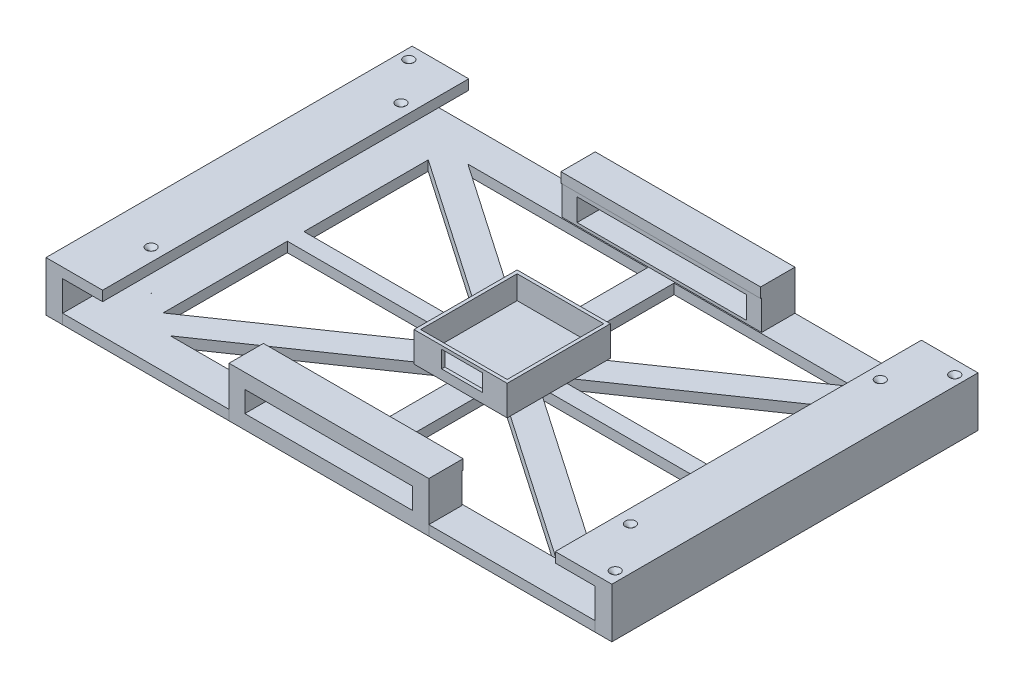
from build123d import *

# Parameters (mm, degrees)
BOSS_EXTRUDE1_DEPTH                   = 3
SKETCH1_5_W                           = 5
SKETCH1_5_H                           = 110
BOSS_EXTRUDE2_DEPTH                   = 12
SKETCH1_5_W_2                         = 60
SKETCH1_5_H_2                         = 10
BOSS_EXTRUDE2_2_DEPTH                 = 12
BOSS_EXTRUDE2_3_DEPTH                 = 12
BOSS_EXTRUDE2_4_DEPTH                 = 12
SKETCH2_W                             = 17
SKETCH2_H                             = 110
SKETCH2_W_2                           = 60
SKETCH2_H_2                           = 10.3125
BOSS_EXTRUDE3_DEPTH                   = 3
SKETCH3_W                             = 50.351183416
SKETCH3_H                             = 6.317122643
CUT_EXTRUDE1_DEPTH                    = 12
SKETCH4_W                             = 50.90857659
SKETCH4_H                             = 6.688718092
CUT_EXTRUDE2_DEPTH                    = 12
SKETCH5_W                             = 28
SKETCH5_H                             = 31
BOSS_EXTRUDE4_DEPTH                   = 9
SKETCH6_W                             = 26
SKETCH6_H                             = 29
CUT_EXTRUDE3_DEPTH                    = 7
SKETCH7_W                             = 12.321460949
SKETCH7_H                             = 5.119870138
CUT_EXTRUDE4_DEPTH                    = 2
F_97_0_0059_DIAMETER_HOLE9_AT_2_COUNT = 2
F_97_0_0059_DIAMETER_HOLE9_AT_2_PITCH = 75.062280812
F_97_0_0059_DIAMETER_HOLE9_AT_3_COUNT = 2
F_97_0_0059_DIAMETER_HOLE9_AT_3_PITCH = 162.38349121
F_97_0_0059_DIAMETER_HOLE9_AT_4_COUNT = 2
F_97_0_0059_DIAMETER_HOLE9_AT_4_PITCH = 143.993236706


with BuildPart() as part:
    # Sketch1 → Boss-Extrude1 (new body)
    with BuildSketch(Plane(origin=(0, 0, 0), x_dir=(1, 0, 0), z_dir=(0, 1, 0))):
        Polygon((0, 0), (50, 0), (50, 10), (110, 10), (110, 0), (160, 0), (160, 110), (110, 110), (110, 100), (50, 100), (50, 110), (0, 110), align=None)
        Polygon((22.060541032, 10.3125), (76, 47.39587804), (76, 10.3125), align=None, mode=Mode.SUBTRACT)
        Polygon((15, 15.16662196), (15, 52.5), (69.303095331, 52.5), align=None, mode=Mode.SUBTRACT)
        Polygon((84, 10.3125), (84, 47.39587804), (137.939458968, 10.3125), align=None, mode=Mode.SUBTRACT)
        Polygon((15, 57.5), (15, 94.83337804), (69.303095331, 57.5), align=None, mode=Mode.SUBTRACT)
        Polygon((145, 15.16662196), (90.696904669, 52.5), (145, 52.5), align=None, mode=Mode.SUBTRACT)
        Polygon((22.060541032, 99.6875), (76, 99.6875), (76, 62.60412196), align=None, mode=Mode.SUBTRACT)
        Polygon((145, 57.5), (90.696904669, 57.5), (145, 94.83337804), align=None, mode=Mode.SUBTRACT)
        Polygon((84, 62.60412196), (84, 99.6875), (137.939458968, 99.6875), align=None, mode=Mode.SUBTRACT)
    extrude(amount=BOSS_EXTRUDE1_DEPTH)

    # Sketch5 → Boss-Extrude4 (add)
    with BuildSketch(Plane(origin=(0, 3, 0), x_dir=(1, 0, 0), z_dir=(0, 1, 0))):
        with Locations((80, 55.04790198)):
            Rectangle(SKETCH5_W, SKETCH5_H)
    extrude(amount=BOSS_EXTRUDE4_DEPTH)

    # Sketch6 → Cut-Extrude3 (cut)
    with BuildSketch(Plane(origin=(0, 12, 0), x_dir=(1, 0, 0), z_dir=(0, 1, 0))):
        with Locations((80, 55.04790198)):
            Rectangle(SKETCH6_W, SKETCH6_H)
    extrude(amount=-CUT_EXTRUDE3_DEPTH, mode=Mode.SUBTRACT)

    # Sketch7 → Cut-Extrude4 (cut)
    with BuildSketch(Plane.XY.offset(-39.54790198)):
        with Locations((80.452241745, 8.456025881)):
            Rectangle(SKETCH7_W, SKETCH7_H)
    extrude(amount=-CUT_EXTRUDE4_DEPTH, mode=Mode.SUBTRACT)


with BuildPart() as body_2:
    # Sketch1<5> → Boss-Extrude2 (new body)
    with BuildSketch(Plane(origin=(0, 0, 0), x_dir=(1, 0, 0), z_dir=(0, 1, 0))):
        with Locations((-2.5, 55)):
            Rectangle(SKETCH1_5_W, SKETCH1_5_H)
    extrude(amount=BOSS_EXTRUDE2_DEPTH)



with BuildPart() as body_3:
    # Sketch1<5> → Boss-Extrude2 2 (new body)
    with BuildSketch(Plane(origin=(0, 0, 0), x_dir=(1, 0, 0), z_dir=(0, 1, 0))):
        with Locations((80, 5)):
            Rectangle(SKETCH1_5_W_2, SKETCH1_5_H_2)
    extrude(amount=BOSS_EXTRUDE2_2_DEPTH)


with BuildPart() as body_4:
    # Sketch1<5> → Boss-Extrude2 3 (new body)
    with BuildSketch(Plane(origin=(0, 0, 0), x_dir=(1, 0, 0), z_dir=(0, 1, 0))):
        with Locations((80, 105)):
            Rectangle(SKETCH1_5_W_2, SKETCH1_5_H_2)
    extrude(amount=BOSS_EXTRUDE2_3_DEPTH)


with BuildPart() as body_5:
    # Sketch1<5> → Boss-Extrude2 4 (new body)
    with BuildSketch(Plane(origin=(0, 0, 0), x_dir=(1, 0, 0), z_dir=(0, 1, 0))):
        with Locations((162.5, 55)):
            Rectangle(SKETCH1_5_W, SKETCH1_5_H)
    extrude(amount=BOSS_EXTRUDE2_4_DEPTH)


with BuildPart() as body_2_1:
    add(body_2.part)

    add(body_3.part)  # Boss-Extrude3 merges body 3

    add(body_4.part)  # Boss-Extrude3 merges body 4

    add(body_5.part)  # Boss-Extrude3 merges body 5
    # Sketch2 → Boss-Extrude3 (add)
    with BuildSketch(Plane(origin=(0, 12, 0), x_dir=(1, 0, 0), z_dir=(0, 1, 0))):
        with Locations((3.5, 55)):
            Rectangle(SKETCH2_W, SKETCH2_H)
        with Locations((156.5, 55)):
            Rectangle(SKETCH2_W, SKETCH2_H)
        with Locations((80, 104.84375)):
            Rectangle(SKETCH2_W_2, SKETCH2_H_2)
        with Locations((80, 5.15625)):
            Rectangle(SKETCH2_W_2, SKETCH2_H_2)
    extrude(amount=BOSS_EXTRUDE3_DEPTH)

    # Sketch3 → Cut-Extrude1 (cut)
    with BuildSketch(Plane.XY):
        with Locations((79.907101138, 7.407101137)):
            Rectangle(SKETCH3_W, SKETCH3_H)
    extrude(amount=-CUT_EXTRUDE1_DEPTH, mode=Mode.SUBTRACT)

    # Sketch4 → Cut-Extrude2 (cut)
    with BuildSketch(Plane(origin=(0, 0, -110), x_dir=(-1, 0, 0), z_dir=(0, 0, -1))):
        with Locations((-80, 7.221303413)):
            Rectangle(SKETCH4_W, SKETCH4_H)
    extrude(amount=-CUT_EXTRUDE2_DEPTH, mode=Mode.SUBTRACT)

    # Sketch14 → #97 (0.0059) Diameter Hole2 (revolve, cut)
    with BuildSketch(Plane(origin=(-2, 15, -106), x_dir=(0, 0, 1), z_dir=(1, 0, 0))):
        Polygon((0, 0), (0, 15), (0.07493, 15), (0.07493, 1.205257537), (1.5113, 0), align=None)
    revolve(axis=Axis((-2, 21.35, -106), (0, -1, 0)), mode=Mode.SUBTRACT)

    # Sketch18 → #97 (0.0059) Diameter Hole4 (revolve, cut)
    with BuildSketch(Plane(origin=(162, 15, -106), x_dir=(0, 0, 1), z_dir=(1, 0, 0))):
        Polygon((0, 0), (0, 15), (0.07493, 15), (0.07493, 1.205257537), (1.5113, 0), align=None)
    revolve(axis=Axis((162, 21.35, -106), (0, -1, 0)), mode=Mode.SUBTRACT)

    # Sketch20 → #97 (0.0059) Diameter Hole5 (revolve, cut)
    with BuildSketch(Plane(origin=(162, 15, -4), x_dir=(0, 0, 1), z_dir=(1, 0, 0))):
        Polygon((0, 0), (0, 15), (0.07493, 15), (0.07493, 1.205257537), (1.5113, 0), align=None)
    revolve(axis=Axis((162, 21.35, -4), (0, -1, 0)), mode=Mode.SUBTRACT)


with BuildPart() as f_97_0_0059_diameter_hole9_tool:
    # Sketch31 → #97 (0.0059) Diameter Hole9 (revolve)
    with BuildSketch(Plane(origin=(8.09628051, 15, -93.553027892), x_dir=(0, 0, 1), z_dir=(1, 0, 0))):
        Polygon((0, 0), (0, 15), (0.07493, 15), (0.07493, 1.205257537), (1.5113, 0), align=None)
    f_97_0_0059_diameter_hole9 = revolve(axis=Axis((8.09628051, 21.35, -93.553027892), (0, -1, 0)))


with BuildPart() as part_1:
    add(part.part)

    # #97 (0.0059) Diameter Hole9: cut by f_97_0_0059_diameter_hole9_tool
    add(f_97_0_0059_diameter_hole9_tool.part, mode=Mode.SUBTRACT)


with BuildPart() as body_2_2:
    add(body_2_1.part)

    # #97 (0.0059) Diameter Hole9: cut by f_97_0_0059_diameter_hole9_tool
    add(f_97_0_0059_diameter_hole9_tool.part, mode=Mode.SUBTRACT)


with BuildPart() as f_97_0_0059_diameter_hole9_at_2_tool:
    # #97 (0.0059) Diameter Hole9 at 2: #97 (0.0059) Diameter Hole9 ×2
    with Locations(*[(0, 0, i * F_97_0_0059_DIAMETER_HOLE9_AT_2_PITCH) for i in range(1, F_97_0_0059_DIAMETER_HOLE9_AT_2_COUNT)]):
        add(f_97_0_0059_diameter_hole9)


with BuildPart() as part_2:
    add(part_1.part)

    # #97 (0.0059) Diameter Hole9 at 2: cut by f_97_0_0059_diameter_hole9_at_2_tool
    add(f_97_0_0059_diameter_hole9_at_2_tool.part, mode=Mode.SUBTRACT)


with BuildPart() as body_2_3:
    add(body_2_2.part)

    # #97 (0.0059) Diameter Hole9 at 2: cut by f_97_0_0059_diameter_hole9_at_2_tool
    add(f_97_0_0059_diameter_hole9_at_2_tool.part, mode=Mode.SUBTRACT)


with BuildPart() as f_97_0_0059_diameter_hole9_at_3_tool:
    # #97 (0.0059) Diameter Hole9 at 3: #97 (0.0059) Diameter Hole9 ×2
    with Locations(*[Vector(0.8867480039532973, 0, 0.4622531530285576) * (i * F_97_0_0059_DIAMETER_HOLE9_AT_3_PITCH) for i in range(1, F_97_0_0059_DIAMETER_HOLE9_AT_3_COUNT)]):
        add(f_97_0_0059_diameter_hole9)


with BuildPart() as part_3:
    add(part_2.part)

    # #97 (0.0059) Diameter Hole9 at 3: cut by f_97_0_0059_diameter_hole9_at_3_tool
    add(f_97_0_0059_diameter_hole9_at_3_tool.part, mode=Mode.SUBTRACT)


with BuildPart() as body_2_4:
    add(body_2_3.part)

    # #97 (0.0059) Diameter Hole9 at 3: cut by f_97_0_0059_diameter_hole9_at_3_tool
    add(f_97_0_0059_diameter_hole9_at_3_tool.part, mode=Mode.SUBTRACT)


with BuildPart() as f_97_0_0059_diameter_hole9_at_4_tool:
    # #97 (0.0059) Diameter Hole9 at 4: #97 (0.0059) Diameter Hole9 ×2
    with Locations(*[(i * F_97_0_0059_DIAMETER_HOLE9_AT_4_PITCH, 0, 0) for i in range(1, F_97_0_0059_DIAMETER_HOLE9_AT_4_COUNT)]):
        add(f_97_0_0059_diameter_hole9)


with BuildPart() as part_4:
    add(part_3.part)

    # #97 (0.0059) Diameter Hole9 at 4: cut by f_97_0_0059_diameter_hole9_at_4_tool
    add(f_97_0_0059_diameter_hole9_at_4_tool.part, mode=Mode.SUBTRACT)


with BuildPart() as body_2_5:
    add(body_2_4.part)

    # #97 (0.0059) Diameter Hole9 at 4: cut by f_97_0_0059_diameter_hole9_at_4_tool
    add(f_97_0_0059_diameter_hole9_at_4_tool.part, mode=Mode.SUBTRACT)


solid = Compound([part_4.part, body_2_5.part])
